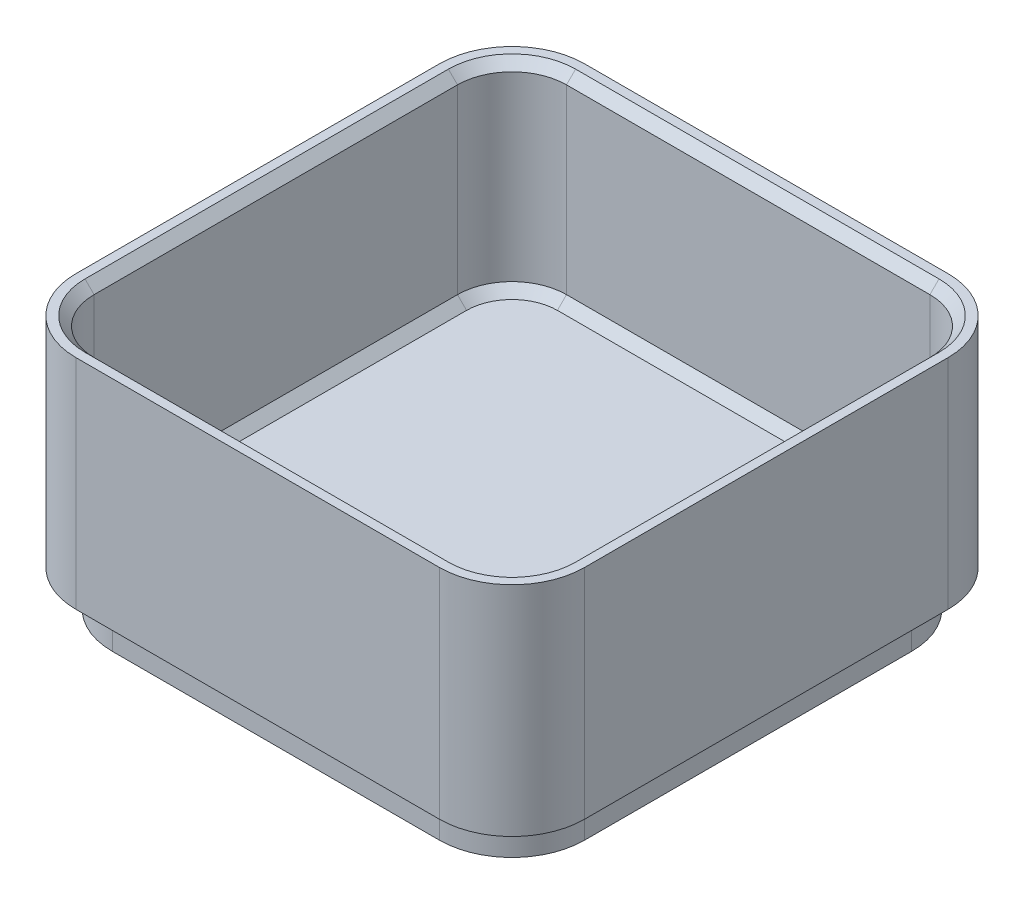
from build123d import *

# Parameters (mm, degrees)
BOSS_EXTRUDE4_DEPTH = 5
SKETCH6_W           = 70
SKETCH6_H           = 70
BOSS_EXTRUDE5_DEPTH = 30
SKETCH8_R           = 3
CUT_EXTRUDE1_DEPTH  = 2
FILLET1_R           = 10
CUT_EXTRUDE2_DEPTH  = 30
BOSS_EXTRUDE6_DEPTH = 2.5
CHAMFER1_SIZE       = 1.25


with BuildPart() as part:
    # Sketch5 → Boss-Extrude4 (new body)
    with BuildSketch(Plane(origin=(0, 0, 0), x_dir=(1, 0, 0), z_dir=(0, 1, 0))):
        with BuildLine():
            Line((-22.5, -32.5), (22.5, -32.5))
            ThreePointArc((22.5, -32.5), (29.571067812, -29.571067812), (32.5, -22.5))
            Line((32.5, -22.5), (32.5, 22.5))
            ThreePointArc((32.5, 22.5), (29.571067812, 29.571067812), (22.5, 32.5))
            Line((22.5, 32.5), (-22.5, 32.5))
            ThreePointArc((-22.5, 32.5), (-29.571067812, 29.571067812), (-32.5, 22.5))
            Line((-32.5, 22.5), (-32.5, -22.5))
            ThreePointArc((-32.5, -22.5), (-29.571067812, -29.571067812), (-22.5, -32.5))
        make_face()
    extrude(amount=BOSS_EXTRUDE4_DEPTH)

    # Sketch6 → Boss-Extrude5 (add)
    with BuildSketch(Plane(origin=(0, 5, 0), x_dir=(1, 0, 0), z_dir=(0, 1, 0))):
        Rectangle(SKETCH6_W, SKETCH6_H)
    extrude(amount=BOSS_EXTRUDE5_DEPTH)

    # Sketch8 → Cut-Extrude1 (cut)
    with BuildSketch(Plane.XZ):
        with Locations(Location((26.037533906, -26.035533906, 0), (0, 0, 270))):
            Circle(SKETCH8_R)
        with Locations(Location((26.036533906, 26.036533906, 0), (0, 0, 270))):
            Circle(SKETCH8_R)
        with BuildLine():
            ThreePointArc((-23.035533906, 26.035533906), (-24.887483609, 28.807172503), (-28.156854249, 28.156854249))
            Line((-28.156854249, 28.156854249), (-23.914213562, 23.914213562))
            ThreePointArc((-23.914213562, 23.914213562), (-23.263895308, 24.887483609), (-23.035533906, 26.035533906))
        make_face()
        with BuildLine():
            Line((-23.914213562, 23.914213562), (-28.156854249, 28.156854249))
            ThreePointArc((-28.156854249, 28.156854249), (-28.156854249, 23.914213562), (-23.914213562, 23.914213562))
        make_face()
        with Locations(Location((-26.034533906, -26.036533906, 0), (0, 0, 270))):
            Circle(SKETCH8_R)
    extrude(amount=-CUT_EXTRUDE1_DEPTH, mode=Mode.SUBTRACT)

    # Fillet1
    fillet1_edges = [part.edges().sort_by_distance(p)[0] for p in [
        (-35, 20, -35),
        (-35, 20, 35),
        (35, 20, 35),
        (35, 20, -35),
    ]]
    fillet(fillet1_edges, radius=FILLET1_R)

    # Sketch9 → Cut-Extrude2 (cut)
    with BuildSketch(Plane(origin=(0, 35, 0), x_dir=(1, 0, 0), z_dir=(0, 1, 0))):
        with BuildLine():
            Line((25, 32.5), (-25, 32.5))
            ThreePointArc((-25, 32.5), (-30.303300859, 30.303300859), (-32.5, 25))
            Line((-32.5, 25), (-32.5, -25))
            ThreePointArc((-32.5, -25), (-30.303300859, -30.303300859), (-25, -32.5))
            Line((-25, -32.5), (25, -32.5))
            ThreePointArc((25, -32.5), (30.303300859, -30.303300859), (32.5, -25))
            Line((32.5, -25), (32.5, 25))
            ThreePointArc((32.5, 25), (30.303300859, 30.303300859), (25, 32.5))
        make_face()
    extrude(amount=-CUT_EXTRUDE2_DEPTH, mode=Mode.SUBTRACT)


with BuildPart() as cut_extrude2_piece_1:
    # of the separate pieces the step leaves, piece 1, a body of its own (cut_extrude2_pieces)
    add(part.part.solids().sort_by_distance((-22.5, 0, 32.5))[0])



with BuildPart() as cut_extrude2_piece_2:
    # of the separate pieces the step leaves, piece 2, a body of its own (cut_extrude2_pieces)
    add(part.part.solids().sort_by_distance((25, 5, -35))[0])


with BuildPart() as cut_extrude2_piece_1_1:
    add(cut_extrude2_piece_1.part)

    add(cut_extrude2_piece_2.part)  # Boss-Extrude6 merges Cut-Extrude2 piece 2
    # Sketch10 → Boss-Extrude6 (add)
    with BuildSketch(Plane.XZ.offset(-5)):
        with BuildLine():
            Line((-35, 25), (-35, -25))
            ThreePointArc((-35, -25), (-32.071067812, -32.071067812), (-25, -35))
            Line((-25, -35), (25, -35))
            ThreePointArc((25, -35), (32.071067812, -32.071067812), (35, -25))
            Line((35, -25), (35, 25))
            ThreePointArc((35, 25), (32.071067812, 32.071067812), (25, 35))
            Line((25, 35), (-25, 35))
            ThreePointArc((-25, 35), (-32.071067812, 32.071067812), (-35, 25))
        make_face()
    extrude(amount=-BOSS_EXTRUDE6_DEPTH)

    # Chamfer1
    chamfer1_edges = [cut_extrude2_piece_1_1.edges().sort_by_distance(p)[0] for p in [
        (0, 35, -32.5),
        (-30.303300859, 35, -30.303300859),
        (-32.5, 35, 0),
        (-30.303300859, 35, 30.303300859),
        (0, 35, 32.5),
        (30.303300859, 35, 30.303300859),
        (32.5, 35, 0),
        (30.303300859, 7.5, -30.303300859),
        (0, 7.5, -32.5),
        (-30.303300859, 7.5, -30.303300859),
        (-32.5, 7.5, 0),
        (-30.303300859, 7.5, 30.303300859),
        (0, 7.5, 32.5),
        (30.303300859, 7.5, 30.303300859),
        (32.5, 7.5, 0),
        (30.303300859, 35, -30.303300859),
    ]]
    chamfer(chamfer1_edges, length=CHAMFER1_SIZE)


solid = cut_extrude2_piece_1_1.part
